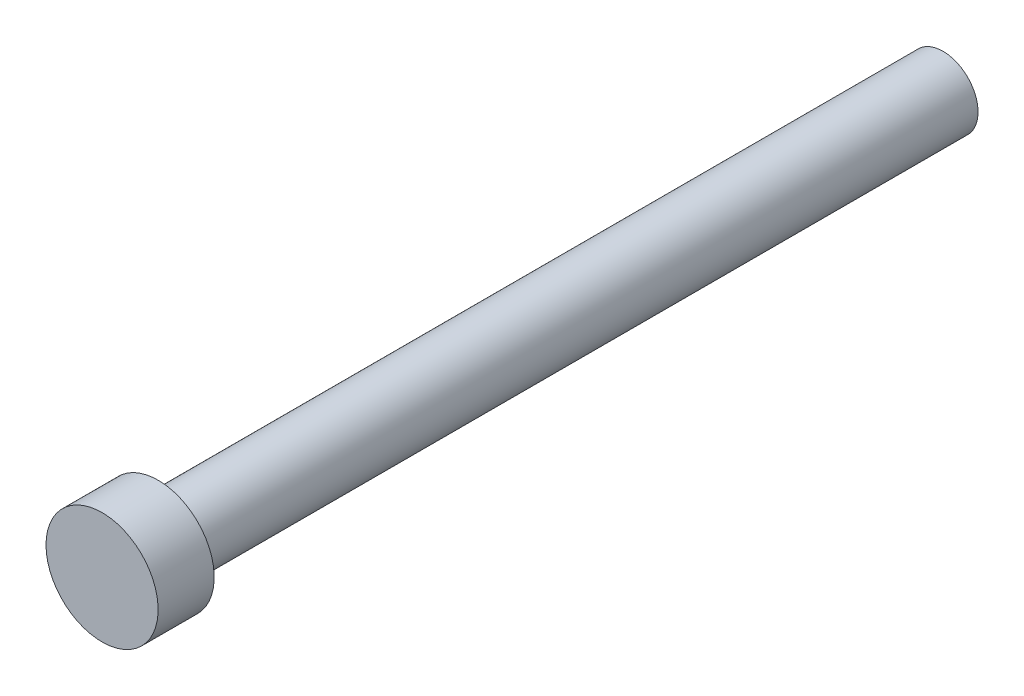
from build123d import *


with BuildPart() as part:
    # Sketch1 → Revolve1 (revolve)
    with BuildSketch(Plane.XZ, mode=Mode.PRIVATE) as revolve1_sk:
        Polygon((5.08, 76.2), (0, 76.2), (0, 0), (3.175, 0), (3.175, 71.12), (5.08, 71.12), align=None)
    revolve(revolve1_sk.sketch.rotate(Axis((0, 0, 76.2), (0, 0, -1)), 180), axis=Axis((0, 0, 76.2), (0, 0, -1)))


solid = part.part
